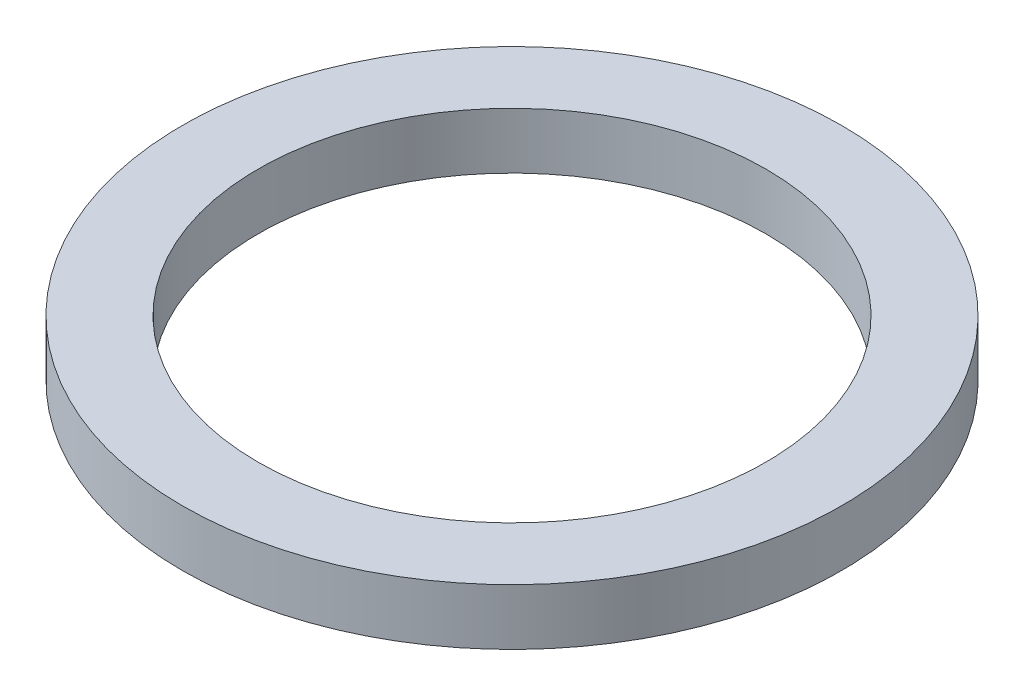
from build123d import *

# Parameters (mm, degrees)
SKETCH1_R           = 37.2872
SKETCH1_R_2         = 28.7274
BOSS_EXTRUDE1_DEPTH = 6.35


with BuildPart() as part:
    # Sketch1 → Boss-Extrude1 (new body)
    with BuildSketch(Plane(origin=(0, 0, 0), x_dir=(1, 0, 0), z_dir=(0, 1, 0))):
        with Locations(Location((0, 0, 0), (0, 0, 270))):
            Circle(SKETCH1_R)
        with Locations(Location((0, 0, 0), (0, 0, 270))):
            Circle(SKETCH1_R_2, mode=Mode.SUBTRACT)
    extrude(amount=BOSS_EXTRUDE1_DEPTH)


solid = part.part
